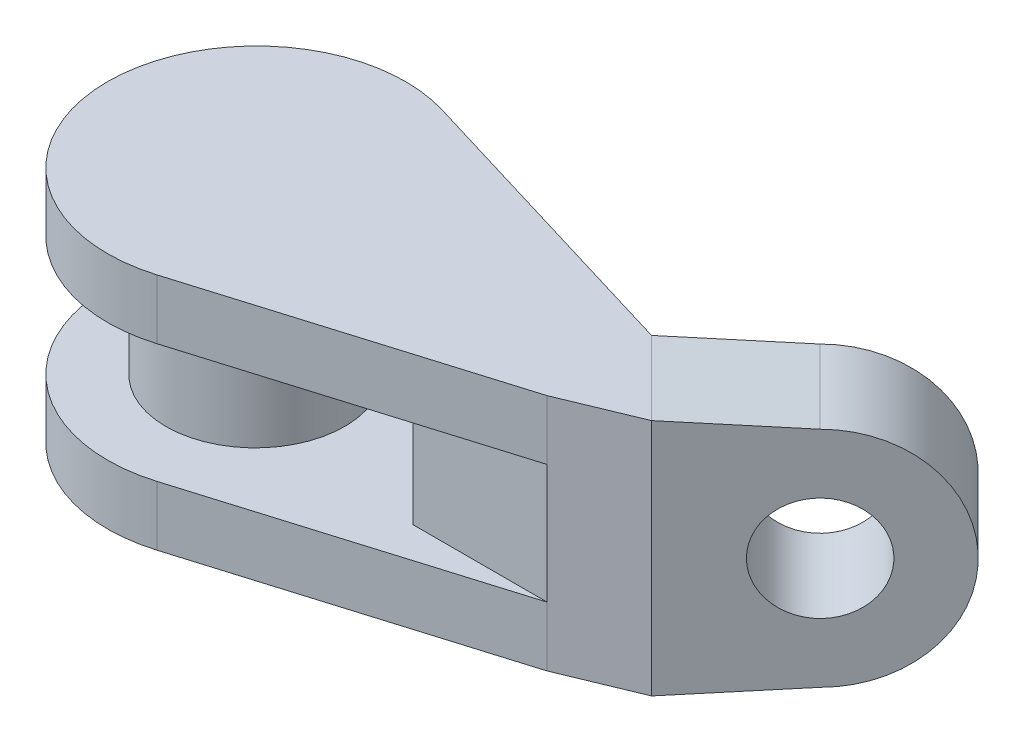
from build123d import *

# Parameters (mm, degrees)
BOSS_EXTRUDE1_DEPTH             = 35
BOSS_EXTRUDE2_START             = -40
BOSS_EXTRUDE2_DEPTH             = 80
SKETCH7_R                       = 17.5
BOSS_EXTRUDE8_DEPTH             = 35
BOSS_EXTRUDE9_REACH             = 208.04
BOSS_EXTRUDE9_DIRECTION_2_REACH = 208.04
BOSS_EXTRUDE6_DEPTH             = 20
BOSS_EXTRUDE6_DEPTH_BACK        = 20
SKETCH5_R                       = 30
BOSS_EXTRUDE10_DEPTH            = 20


with BuildPart() as part:
    # Sketch1 → Boss-Extrude1 (new body)
    with BuildSketch(Plane.XY):
        Polygon((0, -20), (70, -20), (70, 20), (0, 20), (0, 40), (100, 40), (115, 40), (115, -40), (100, -40), (0, -40), align=None)
    extrude(amount=BOSS_EXTRUDE1_DEPTH)


with BuildPart() as body_2:
    # Sketch2 → Boss-Extrude2 (new body)
    with BuildSketch(Plane(origin=(0, 0, 0), x_dir=(1, 0, 0), z_dir=(0, 1, 0)).offset(BOSS_EXTRUDE2_START)):
        Polygon((115, -35), (115, 0), (143.284271247, 28.284271247), (160.784271247, 10.784271247), align=None)
    extrude(amount=BOSS_EXTRUDE2_DEPTH)


with BuildPart() as body_3:
    # Sketch7 → Boss-Extrude8 (new body)
    with BuildSketch(Plane(origin=(57.5, 0, 57.5), x_dir=(-0.7071067811865485, 0, 0.7071067811865466), z_dir=(-0.7071067811865466, 0, -0.7071067811865485))):
        with BuildLine():
            Line((-121.317279836, 37.5), (-81.317279836, 40))
            Line((-81.317279836, 40), (-81.317279836, -40))
            Line((-81.317279836, -40), (-121.317279836, -37.5))
            ThreePointArc((-121.317279836, -37.5), (-158.817279836, 0), (-121.317279836, 37.5))
        make_face()
        with Locations((-121.317279836, 0)):
            Circle(SKETCH7_R, mode=Mode.SUBTRACT)
    extrude(amount=-BOSS_EXTRUDE8_DEPTH)


with BuildPart() as body_4:

    # Boss-Extrude9: up to this face of the body (flat: up to its plane)
    boss_extrude9_end = Plane(part.part.faces().sort_by_distance((57.5, 40, 17.5))[0])
    # Sketch9 → Boss-Extrude9 (new, up to the picked face)
    with BuildSketch(Plane(origin=(0, 0, 0), x_dir=(1, 0, 0), z_dir=(0, 1, 0)), mode=Mode.PRIVATE) as boss_extrude9_sk1:
        Polygon((139.748737342, -24.748737342), (115, 0), (115, -35), align=None)
    boss_extrude9_tool1 = split(extrude(boss_extrude9_sk1.sketch, amount=BOSS_EXTRUDE9_REACH, mode=Mode.PRIVATE), bisect_by=boss_extrude9_end, keep=Keep.BOTH, mode=Mode.PRIVATE)
    add(boss_extrude9_tool1.solids().sort_by(Axis((123.249579, 0, 19.916246), (0, 1, 0)))[0])


    # Boss-Extrude9 direction 2: up to this face of the body (flat: up to its plane)
    boss_extrude9_direction_2_end = Plane(part.part.faces().sort_by_distance((57.5, -40, 17.5))[0])
    # Sketch9 → Boss-Extrude9 direction 2 (add, up to the picked face)
    with BuildSketch(Plane(origin=(0, 0, 0), x_dir=(1, 0, 0), z_dir=(0, 1, 0)), mode=Mode.PRIVATE) as boss_extrude9_direction_2_sk1:
        Polygon((139.748737342, -24.748737342), (115, 0), (115, -35), align=None)
    boss_extrude9_direction_2_tool1 = split(extrude(boss_extrude9_direction_2_sk1.sketch, amount=-BOSS_EXTRUDE9_DIRECTION_2_REACH, mode=Mode.PRIVATE), bisect_by=boss_extrude9_direction_2_end, keep=Keep.BOTH, mode=Mode.PRIVATE)
    add(boss_extrude9_direction_2_tool1.solids().sort_by(Axis((123.249579, 0, 19.916246), (0, -1, 0)))[0])


with BuildPart() as body_4_2:
    # Sketch5 → Boss-Extrude6 (new, two sides: drawn at the far end of the back side and taken through both)
    with BuildSketch(Plane(origin=(0, 0, 0), x_dir=(1, 0, 0), z_dir=(0, 1, 0)).offset(-BOSS_EXTRUDE6_DEPTH_BACK)):
        with Locations(Location((0, -17.943234711, 0), (0, 0, 270))):
            Circle(SKETCH5_R)
    extrude(amount=BOSS_EXTRUDE6_DEPTH + BOSS_EXTRUDE6_DEPTH_BACK)


with BuildPart() as body_5:
    # Sketch6 → Boss-Extrude10 (new body)
    with BuildSketch(Plane(origin=(0, 20, 0), x_dir=(1, 0, 0), z_dir=(0, 1, 0))):
        with BuildLine():
            Line((115, -35), (46.837484988, -35))
            ThreePointArc((46.837484988, -35), (50, -17.5), (46.837484988, 0))
            Line((46.837484988, 0), (115, 0))
            Line((115, 0), (14.455350542, 30.364839295))
            ThreePointArc((14.455350542, 30.364839295), (-50, -17.5), (14.455350542, -65.364839295))
            Line((14.455350542, -65.364839295), (115, -35))
        make_face()
    extrude(amount=BOSS_EXTRUDE10_DEPTH)


with BuildPart() as body_6:
    # Body-Move/Copy2: copy of body 5
    add(body_5.part.moved(Location((0, -60, 0))))


with BuildPart() as body_5_1:
    add(body_5.part)

    # Combine1: union part, body 4, body 3, body 6, body 4 2
    add(part.part)
    add(body_4.part)
    add(body_3.part)
    add(body_6.part)
    add(body_4_2.part)


solid = body_5_1.part
